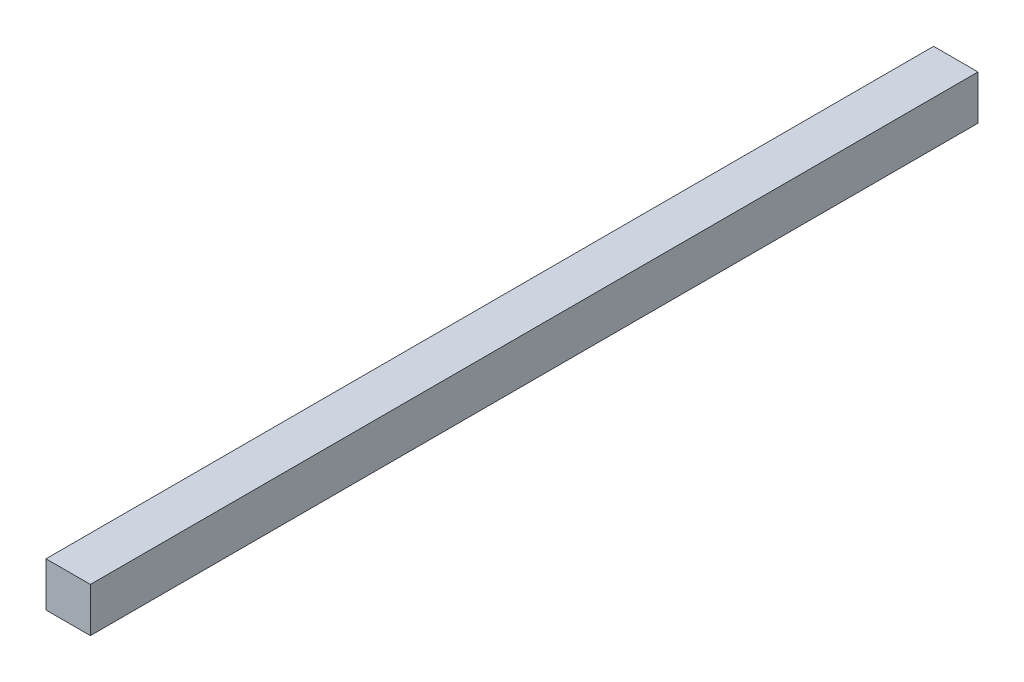
from build123d import *

# Parameters (mm, degrees)
SKETCH_1_W          = 10
SKETCH_1_H          = 10
EXTRUDE_1_DEPTH     = 300
SKETCH_2_W          = 10
SKETCH_2_H          = 10
CUT_EXTRUDE_1_DEPTH = 100


with BuildPart() as part:
    # 草图1 → 凸台-拉伸1 (new body)
    with BuildSketch(Plane.XY):
        Rectangle(SKETCH_1_W, SKETCH_1_H)
    extrude(amount=EXTRUDE_1_DEPTH)

    # 草图2 → 切除-拉伸1 (cut)
    with BuildSketch(Plane(origin=(0, 0, 0), x_dir=(-1, 0, 0), z_dir=(0, 0, -1))):
        Rectangle(SKETCH_2_W, SKETCH_2_H)
    extrude(amount=-CUT_EXTRUDE_1_DEPTH, mode=Mode.SUBTRACT)


solid = part.part
